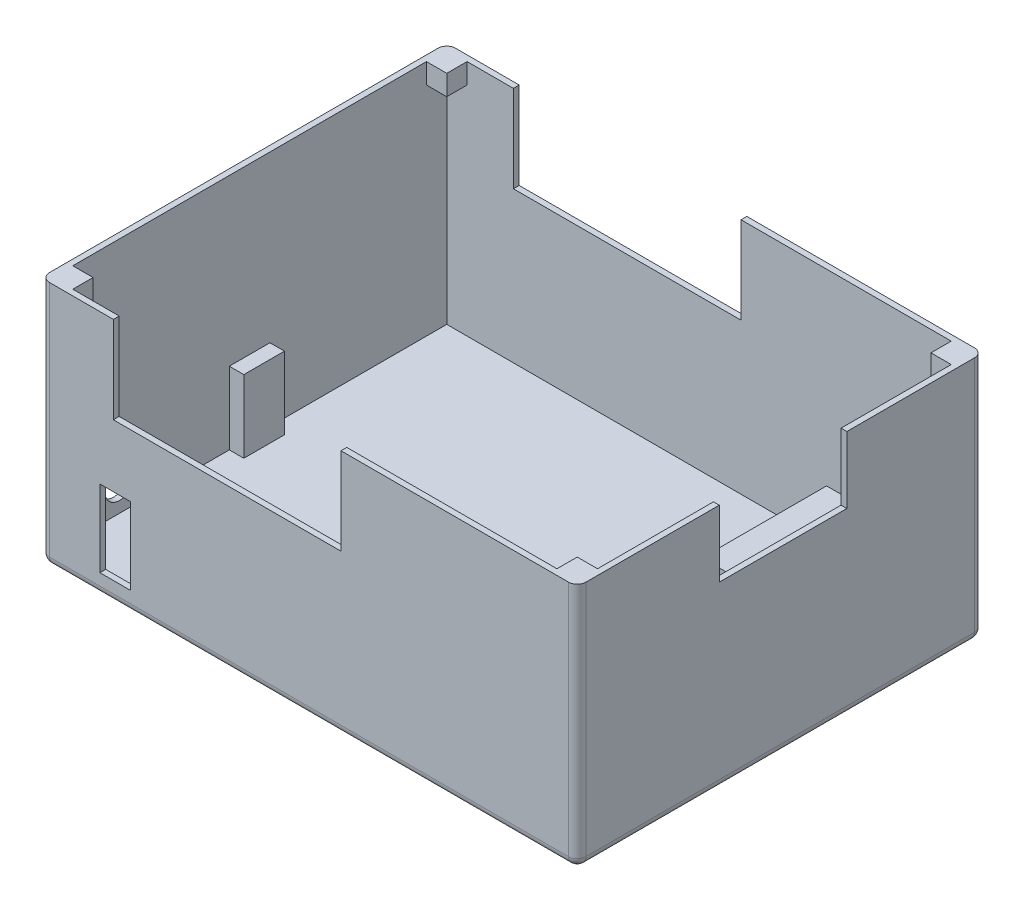
from build123d import *

# Parameters (mm, degrees)
SKETCH1_W            = 185
SKETCH1_H            = 140
BOSS_EXTRUDE1_DEPTH  = 85
SKETCH2_W            = 181
SKETCH2_H            = 136
CUT_EXTRUDE1_DEPTH   = 82
CUT_EXTRUDE3_REACH   = 190.099
SKETCH3_W            = 60
SKETCH3_H            = 30
SKETCH6_W            = 7
SKETCH6_H            = 7
BOSS_EXTRUDE2_DEPTH  = 7
SKETCH7_W            = 7
SKETCH7_H            = 7
BOSS_EXTRUDE3_DEPTH  = 7
SKETCH8_W            = 7
SKETCH8_H            = 7
BOSS_EXTRUDE4_DEPTH  = 7
SKETCH9_W            = 7
SKETCH9_H            = 7
BOSS_EXTRUDE5_DEPTH  = 7
SKETCH11_W           = 50
SKETCH11_H           = 43
BOSS_EXTRUDE6_DEPTH  = 17.25
SKETCH12_W           = 25
SKETCH12_H           = 15
BOSS_EXTRUDE7_DEPTH  = 6.5
SKETCH13_W           = 10
SKETCH13_H           = 30
CUT_EXTRUDE4_DEPTH   = 174
SKETCH14_W           = 14
SKETCH14_H           = 25
BOSS_EXTRUDE8_DEPTH  = 5
SKETCH21_W           = 44
SKETCH21_H           = 23
CUT_EXTRUDE11_DEPTH  = 12
SKETCH23_R           = 5
CUT_EXTRUDE12_DEPTH  = 2
FILLET2_R            = 3
CUT_EXTRUDE13_START  = -140
SKETCH24_W           = 7
SKETCH24_H           = 30
CUT_EXTRUDE13_DEPTH  = 140
CUT_EXTRUDE14_START  = -140
SKETCH25_W           = 1.5
SKETCH25_H           = 30
CUT_EXTRUDE14_DEPTH  = 140
SKETCH26_W           = 17.682031304
SKETCH26_H           = 15.055987051
BOSS_EXTRUDE12_DEPTH = 5
SKETCH27_W           = 10.5
SKETCH27_H           = 26.5
CUT_EXTRUDE15_DEPTH  = 2


with BuildPart() as part:
    # Sketch1 → Boss-Extrude1 (new body)
    with BuildSketch(Plane(origin=(0, 0, 0), x_dir=(1, 0, 0), z_dir=(0, 1, 0))):
        Rectangle(SKETCH1_W, SKETCH1_H)
    extrude(amount=BOSS_EXTRUDE1_DEPTH)

    # Sketch2 → Cut-Extrude1 (cut)
    with BuildSketch(Plane(origin=(0, 85, 0), x_dir=(1, 0, 0), z_dir=(0, 1, 0))):
        Rectangle(SKETCH2_W, SKETCH2_H)
    extrude(amount=-CUT_EXTRUDE1_DEPTH, mode=Mode.SUBTRACT)

    # Cut-Extrude3: up to this face of the body (flat: up to its plane)
    cut_extrude3_end = Plane(part.part.faces().sort_by_distance((0, 42.5, -70))[0])
    # Sketch3 → Cut-Extrude3 (cut, up to the picked face)
    with BuildSketch(Plane.XY.offset(70), mode=Mode.PRIVATE) as cut_extrude3_sk1:
        with Locations((-37.5, 70)):
            Rectangle(SKETCH3_W, SKETCH3_H)
    cut_extrude3_tool1 = split(extrude(cut_extrude3_sk1.sketch, amount=-CUT_EXTRUDE3_REACH, mode=Mode.PRIVATE), bisect_by=cut_extrude3_end, keep=Keep.BOTH, mode=Mode.PRIVATE)
    add(cut_extrude3_tool1.solids().sort_by(Axis((-37.5, 70, 70), (0, 0, -1)))[0], mode=Mode.SUBTRACT)

    # Sketch6 → Boss-Extrude2 (add)
    with BuildSketch(Plane(origin=(0, 0, 68), x_dir=(-1, 0, 0), z_dir=(0, 0, -1))):
        with Locations((87, 81.5)):
            Rectangle(SKETCH6_W, SKETCH6_H)
    extrude(amount=BOSS_EXTRUDE2_DEPTH)

    # Sketch7 → Boss-Extrude3 (add)
    with BuildSketch(Plane.XY.offset(-68)):
        with Locations((-87, 81.5)):
            Rectangle(SKETCH7_W, SKETCH7_H)
    extrude(amount=BOSS_EXTRUDE3_DEPTH)

    # Sketch8 → Boss-Extrude4 (add)
    with BuildSketch(Plane(origin=(0, 0, 68), x_dir=(-1, 0, 0), z_dir=(0, 0, -1))):
        with Locations((-87, 81.5)):
            Rectangle(SKETCH8_W, SKETCH8_H)
    extrude(amount=BOSS_EXTRUDE4_DEPTH)

    # Sketch9 → Boss-Extrude5 (add)
    with BuildSketch(Plane.XY.offset(-68)):
        with Locations((87, 81.5)):
            Rectangle(SKETCH9_W, SKETCH9_H)
    extrude(amount=BOSS_EXTRUDE5_DEPTH)

    # Sketch11 → Boss-Extrude6 (add)
    with BuildSketch(Plane(origin=(0, 3, 0), x_dir=(1, 0, 0), z_dir=(0, 1, 0))):
        with Locations((65.5, 46.5)):
            Rectangle(SKETCH11_W, SKETCH11_H)
    extrude(amount=BOSS_EXTRUDE6_DEPTH)

    # Sketch12 → Boss-Extrude7 (add)
    with BuildSketch(Plane(origin=(0, 3, 0), x_dir=(1, 0, 0), z_dir=(0, 1, 0))):
        with Locations((30, 0)):
            Rectangle(SKETCH12_W, SKETCH12_H)
    extrude(amount=BOSS_EXTRUDE7_DEPTH)

    # Sketch13 → Cut-Extrude4 (cut)
    with BuildSketch(Plane.XY.offset(70)):
        with Locations((-2.5, 70)):
            Rectangle(SKETCH13_W, SKETCH13_H)
    extrude(amount=-CUT_EXTRUDE4_DEPTH, mode=Mode.SUBTRACT)

    # Sketch14 → Boss-Extrude8 (add)
    with BuildSketch(Plane(origin=(-90.5, 0, 0), x_dir=(0, 0, -1), z_dir=(1, 0, 0))):
        with Locations((0, 15.5)):
            Rectangle(SKETCH14_W, SKETCH14_H)
    extrude(amount=BOSS_EXTRUDE8_DEPTH)

    # Sketch21 → Cut-Extrude11 (cut)
    with BuildSketch(Plane(origin=(92.5, 0, 0), x_dir=(0, 0, -1), z_dir=(1, 0, 0))):
        with Locations((1, 73.5)):
            Rectangle(SKETCH21_W, SKETCH21_H)
    extrude(amount=-CUT_EXTRUDE11_DEPTH, mode=Mode.SUBTRACT)

    # Sketch23 → Cut-Extrude12 (cut)
    with BuildSketch(Plane.ZY.offset(92.5)):
        with Locations((44.895607786, 11.841525816)):
            Circle(SKETCH23_R)
    extrude(amount=-CUT_EXTRUDE12_DEPTH, mode=Mode.SUBTRACT)

    # Fillet2
    fillet2_edges = [part.edges().sort_by_distance(p)[0] for p in [
        (0, 0, -70),
        (92.5, 0, 0),
        (0, 0, 70),
        (-92.5, 0, 0),
        (-92.5, 42.5, -70),
        (92.5, 42.5, -70),
        (92.5, 42.5, 70),
        (-92.5, 42.5, 70),
    ]]
    fillet(fillet2_edges, radius=FILLET2_R)

    # Sketch24 → Cut-Extrude13 (cut)
    with BuildSketch(Plane(origin=(0, 0, -70), x_dir=(-1, 0, 0), z_dir=(0, 0, -1)).offset(CUT_EXTRUDE13_START)):
        with Locations((-6, 70)):
            Rectangle(SKETCH24_W, SKETCH24_H)
    extrude(amount=CUT_EXTRUDE13_DEPTH, mode=Mode.SUBTRACT)

    # Sketch25 → Cut-Extrude14 (cut)
    with BuildSketch(Plane(origin=(0, 0, -70), x_dir=(-1, 0, 0), z_dir=(0, 0, -1)).offset(CUT_EXTRUDE14_START)):
        with Locations((-10.25, 70)):
            Rectangle(SKETCH25_W, SKETCH25_H)
    extrude(amount=CUT_EXTRUDE14_DEPTH, mode=Mode.SUBTRACT)

    # Sketch26 → Boss-Extrude12 (add)
    with BuildSketch(Plane(origin=(0, 3, 0), x_dir=(1, 0, 0), z_dir=(0, 1, 0))):
        with Locations((2.188370211, -27.472006474)):
            Rectangle(SKETCH26_W, SKETCH26_H)
    extrude(amount=BOSS_EXTRUDE12_DEPTH)

    # Sketch27 → Cut-Extrude15 (cut)
    with BuildSketch(Plane.XY.offset(70)):
        with Locations((-66.878682152, 20.25)):
            Rectangle(SKETCH27_W, SKETCH27_H)
    extrude(amount=-CUT_EXTRUDE15_DEPTH, mode=Mode.SUBTRACT)


solid = part.part
